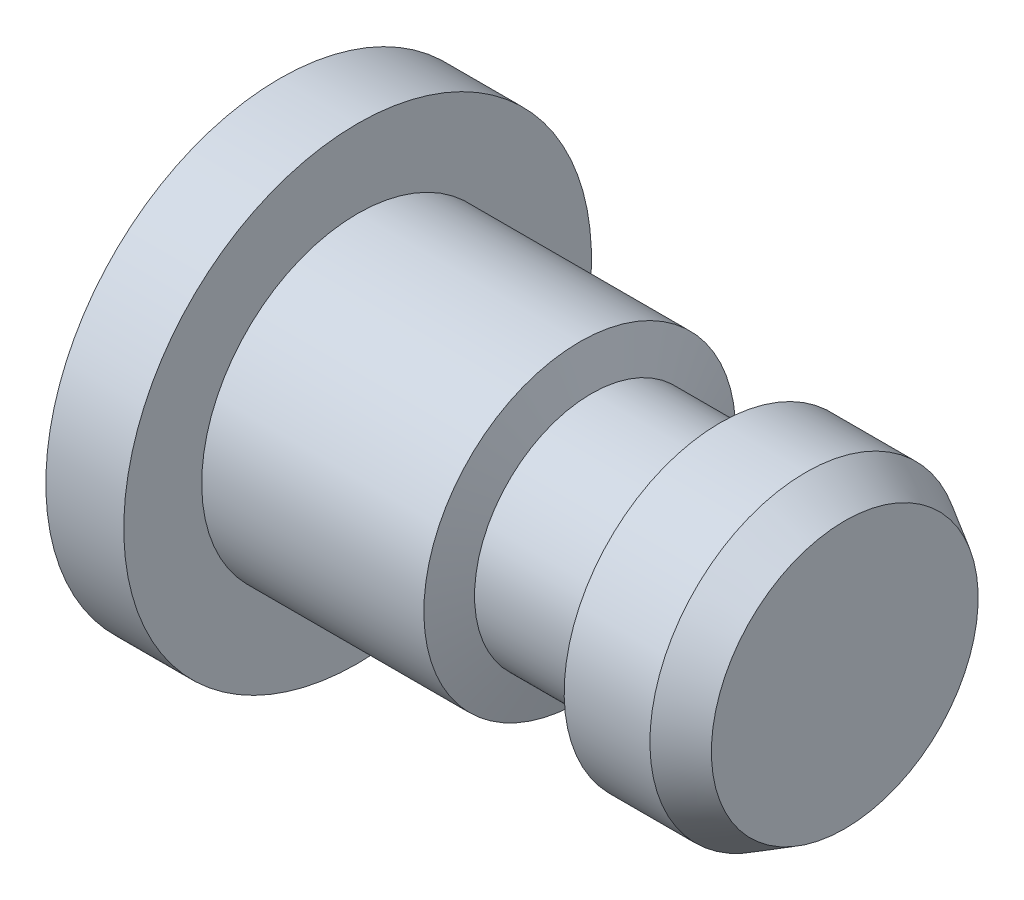
from build123d import *

# Parameters (mm, degrees)
CHAMFER1_SIZE  = 1
CHAMFER1_SIZE2 = 0.577350269


with BuildPart() as part:
    # Sketch1 → Revolve1 (revolve)
    with BuildSketch(Plane.XY):
        Polygon((0, 0), (0, 6), (2, 6), (2, 4), (7.7, 4), (8, 3), (11, 3), (11.3, 4), (14.5, 4), (14.5, 0), align=None)
    revolve(axis=Axis((14.5, 0, 0), (-1, 0, 0)))

    # Chamfer1
    chamfer1_edges = [part.edges().sort_by_distance(p)[0] for p in [
        (14.5, -4, 0),
    ]]
    chamfer1_side = [part.faces().sort_by_distance(p)[0] for p in [
        (12.9, -4, 0),
    ]]
    chamfer(chamfer1_edges, length=CHAMFER1_SIZE, length2=CHAMFER1_SIZE2, reference=chamfer1_side[0])


solid = part.part
